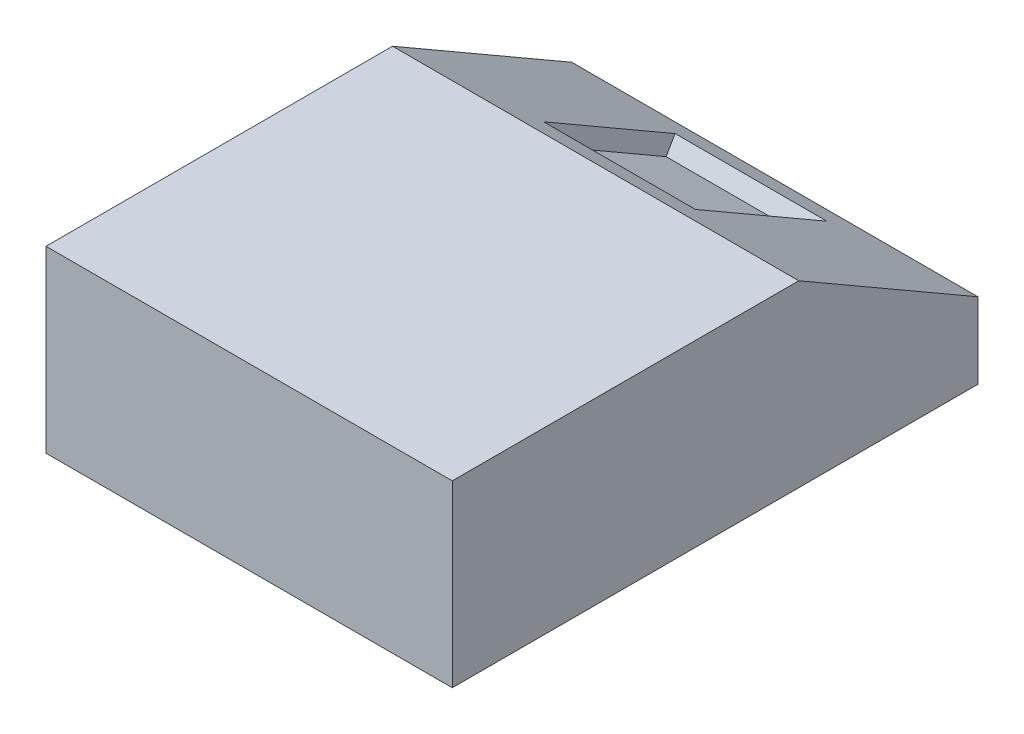
from build123d import *

# Parameters (mm, degrees)
SKETCH2_W           = 68
SKETCH2_H           = 88
SKETCH2_W_2         = 62
SKETCH2_H_2         = 82
BOSS_EXTRUDE1_DEPTH = 30
CHAMFER1_SIZE       = 30
CHAMFER1_SIZE2      = 17.320508076
SHELL1_T            = -3
CUT_EXTRUDE1_REACH  = 77.039
SKETCH3_W           = 25.4
SKETCH3_H           = 25.4


with BuildPart() as part:
    # Sketch2 → Boss-Extrude1 (new body)
    # profile 1 of 2: a face of its own
    with BuildSketch(Plane(origin=(0, 0, 0), x_dir=(1, 0, 0), z_dir=(0, 1, 0))):
        Rectangle(SKETCH2_W, SKETCH2_H)
        Rectangle(SKETCH2_W_2, SKETCH2_H_2, mode=Mode.SUBTRACT)
    # profile 2 of 2: a face of its own
    with BuildSketch(Plane(origin=(0, 0, 0), x_dir=(1, 0, 0), z_dir=(0, 1, 0))):
        Rectangle(SKETCH2_W_2, SKETCH2_H_2)
    extrude(amount=BOSS_EXTRUDE1_DEPTH)

    # Chamfer1
    chamfer1_edges = [part.edges().sort_by_distance(p)[0] for p in [
        (0, 30, -44),
    ]]
    chamfer1_side = [part.faces().sort_by_distance(p)[0] for p in [
        (0, 30, 0),
    ]]
    chamfer(chamfer1_edges, length=CHAMFER1_SIZE, length2=CHAMFER1_SIZE2, reference=chamfer1_side[0])

    # Shell1
    shell1_openings = [part.faces().sort_by_distance(p)[0] for p in [
        (0, 0, 0),
    ]]
    offset(amount=SHELL1_T, openings=shell1_openings, kind=Kind.INTERSECTION)

    # Sketch3 → Cut-Extrude1 (cut, up to next)
    with BuildSketch(Plane(origin=(0, 28.562177826, -16.490381057), x_dir=(1, 0, 0), z_dir=(0, 0.8660254037844398, -0.4999999999999982)), mode=Mode.PRIVATE) as cut_extrude1_sk1:
        with Locations((0, 14.444863729)):
            Rectangle(SKETCH3_W, SKETCH3_H)
    cut_extrude1_tool1 = extrude(cut_extrude1_sk1.sketch, amount=-CUT_EXTRUDE1_REACH, mode=Mode.PRIVATE) & part.part
    add(cut_extrude1_tool1.solids().sort_by_distance((0, 21.339746, -29))[0], mode=Mode.SUBTRACT)


solid = part.part
